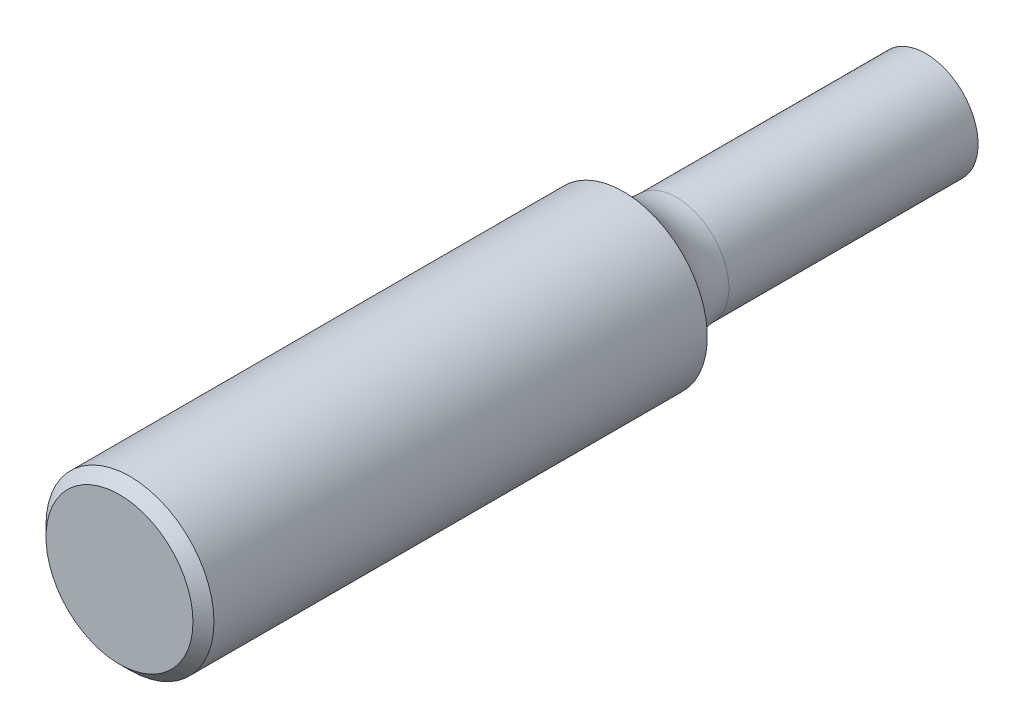
from build123d import *

# Parameters (mm, degrees)
CHAFL_N1_SIZE = 0.396875


with BuildPart() as part:
    # Croquis1 → Revolución1 (revolve)
    with BuildSketch(Plane(origin=(0, 0, 0), x_dir=(0, 0, -1), z_dir=(1, 0, 0)), mode=Mode.PRIVATE) as revoluci_n1_sk:
        with BuildLine():
            Line((-15.24, 0), (-15.24, 3.175))
            Line((-15.24, 3.175), (3.81, 3.175))
            ThreePointArc((3.81, 3.175), (4.650083071, 2.302185344), (5.818206951, 1.9812))
            Line((5.818206951, 1.9812), (15.24, 1.9812))
            Line((15.24, 1.9812), (15.24, 0))
            Line((15.24, 0), (-15.24, 0))
        make_face()
    revolve(revoluci_n1_sk.sketch.rotate(Axis((0, 0, -127), (0, 0, 1)), 90), axis=Axis((0, 0, -127), (0, 0, 1)))

    # Croquis4 → Cortar-Revolución1 (revolve, cut)
    with BuildSketch(Plane(origin=(0, 0, 0), x_dir=(0, 0, -1), z_dir=(1, 0, 0)), mode=Mode.PRIVATE) as cortar_revoluci_n1_sk:
        with BuildLine():
            ThreePointArc((15.24, 1.722711816), (14.861646983, 0.898025612), (14.732, 0))
            Line((14.732, 0), (15.24, 0))
            Line((15.24, 0), (15.24, 1.722711816))
        make_face()
        with BuildLine():
            ThreePointArc((14.732, 0), (14.861646983, 0.898025612), (15.24, 1.722711816))
            Line((15.24, 1.722711816), (15.24, 0))
            Line((15.24, 0), (14.732, 0))
        make_face()
    revolve(cortar_revoluci_n1_sk.sketch.rotate(Axis((0, 0, -15.24), (0, 0, 1)), 180), axis=Axis((0, 0, -15.24), (0, 0, 1)), mode=Mode.SUBTRACT)

    # Chaflán1
    chafl_n1_edges = [part.edges().sort_by_distance(p)[0] for p in [
        (3.175, 0, 15.24),
    ]]
    chamfer(chafl_n1_edges, length=CHAFL_N1_SIZE)


solid = part.part
